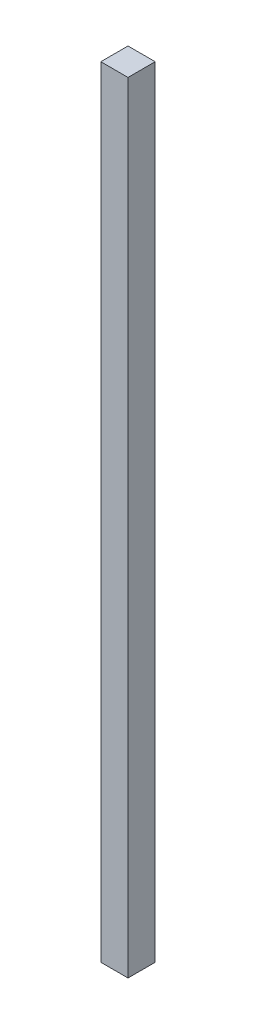
from build123d import *

# Parameters (mm, degrees)
SKETCH1_W           = 38.1
SKETCH1_H           = 38.1
BOSS_EXTRUDE1_DEPTH = 1092.2


with BuildPart() as part:
    # Sketch1 → Boss-Extrude1 (new body)
    with BuildSketch(Plane(origin=(0, 0, 0), x_dir=(1, 0, 0), z_dir=(0, 1, 0))):
        with Locations((19.05, 19.05)):
            Rectangle(SKETCH1_W, SKETCH1_H)
    extrude(amount=BOSS_EXTRUDE1_DEPTH)


solid = part.part
